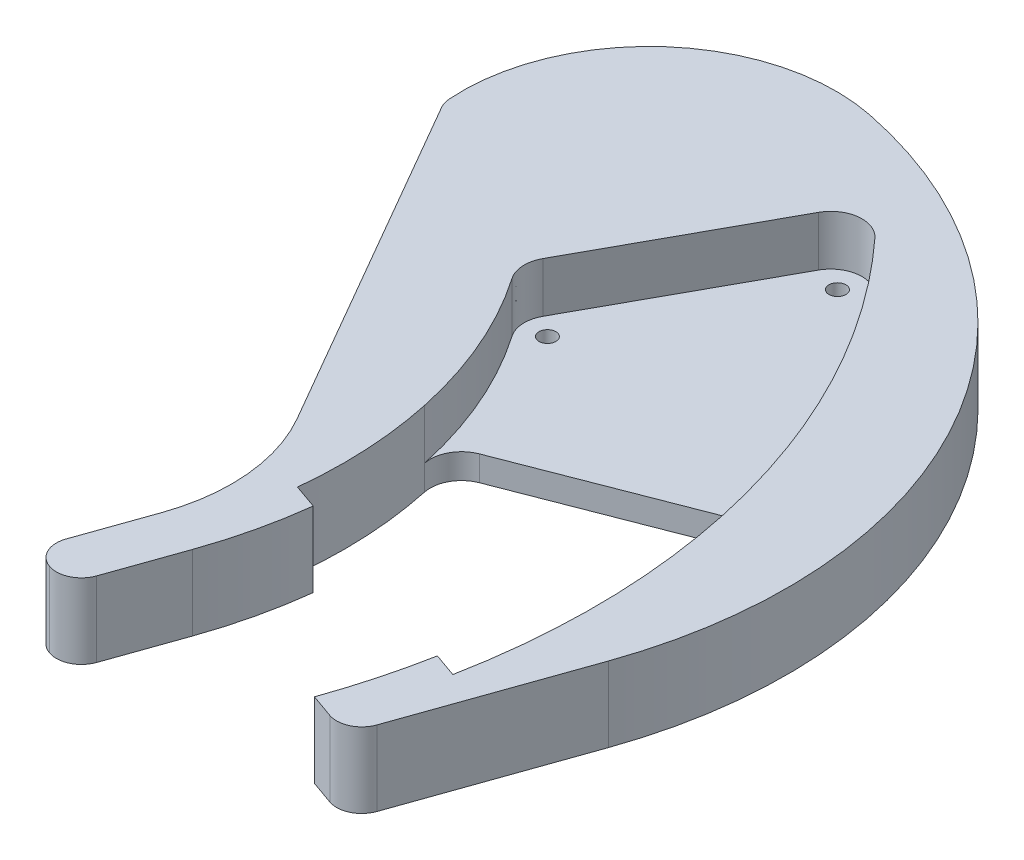
from build123d import *

# Parameters (mm, degrees)
BOSS_EXTRUDE1_DEPTH   = 19.05
CUT_EXTRUDE1_DEPTH    = 219.215212878
CUT_EXTRUDE2_DEPTH    = 12.7
BOSS_EXTRUDE2_DEPTH   = 19.05
FILLET1_R             = 6.35
F_8_CLEARANCE_HOLE1_D = 4.3053


with BuildPart() as part:
    # Sketch1 → Boss-Extrude1 (new body)
    with BuildSketch(Plane(origin=(0, 0, 0), x_dir=(1, 0, 0), z_dir=(0, 1, 0))):
        with BuildLine():
            Line((-47.453228006, 53.404284402), (-98.253228006, 141.392465427))
            ThreePointArc((-98.253228006, 141.392465427), (-82.921975522, 181.453316928), (-41.566473575, 192.839342769))
            ThreePointArc((-41.566473575, 192.839342769), (36.836225704, 136.004392842), (45.380299153, 39.546144899))
            Line((45.380299153, 39.546144899), (27.944541838, -9.861512816))
            Line((27.944541838, -9.861512816), (0, 0))
            Line((0, 0), (-43.950457827, 15.509934128))
            ThreePointArc((-43.950457827, 15.509934128), (-41.550098289, 34.840876427), (-47.453228006, 53.404284402))
        make_face()
    extrude(amount=BOSS_EXTRUDE1_DEPTH)

    # Sketch5 → Cut-Extrude1 (cut, through all)
    with BuildSketch(Plane(origin=(0, 19.05, 0), x_dir=(1, 0, 0), z_dir=(0, 1, 0))):
        with BuildLine():
            Line((-29.23664893, 81.427581144), (15.574383155, 98.792652007))
            ThreePointArc((15.574383155, 98.792652007), (22.053436092, 98.460407789), (26.120098061, 93.405630482))
            ThreePointArc((26.120098061, 93.405630482), (31.67419382, 55.261505814), (28.616328902, 16.836622098))
            Line((28.616328902, 16.836622098), (22.559524164, 18.974043348))
            ThreePointArc((22.559524164, 18.974043348), (19.726825076, 6.545871538), (15.949337201, -5.628454892))
            Line((15.949337201, -5.628454892), (-31.95525319, 11.276876204))
            ThreePointArc((-31.95525319, 11.276876204), (-28.372538305, 23.563648828), (-26.173781301, 36.171824553))
            Line((-26.173781301, 36.171824553), (-32.322028113, 38.341515332))
            ThreePointArc((-32.322028113, 38.341515332), (-31.887912186, 55.427050363), (-34.131380562, 72.370214577))
            ThreePointArc((-34.131380562, 72.370214577), (-33.353370645, 77.801041885), (-29.23664893, 81.427581144))
        make_face()
    extrude(amount=-CUT_EXTRUDE1_DEPTH, mode=Mode.SUBTRACT)

    # Sketch6 → Cut-Extrude2 (cut)
    with BuildSketch(Plane(origin=(0, 19.05, 0), x_dir=(1, 0, 0), z_dir=(0, 1, 0))):
        with BuildLine():
            Line((-34.136031583, 72.371811773), (26.116293886, 93.401758977))
            add(Edge.make_bspline(
                [(26.116293886, 93.401758977), (24.324889601, 100.23803776), (22.130168151, 106.901258397), (16.96212823, 119.893613822), (13.988046064, 126.222420918), (9.776956475, 133.921680991), (8.910007749, 135.450921337), (7.126151123, 138.487965199), (6.207974968, 139.997768114), (3.386426272, 144.480432789), (1.42392697, 147.394611788), (-4.701484626, 155.920269738), (-9.100754748, 161.316287945), (-13.809441186, 166.430246232)],
                knots=[0, 0, 0, 0, 0.25, 0.25, 0.5, 0.5, 0.5625, 0.5625, 0.625, 0.625, 0.75, 0.75, 1, 1, 1, 1], degree=3))
            add(Edge.make_bspline(
                [(-26.604572492, 164.8773905), (-26.150591479, 165.703254328), (-25.515446259, 166.400295605), (-24.879031904, 167.098729697), (-24.095373437, 167.628794259), (-23.313760397, 168.1574753), (-22.428907317, 168.488425961), (-21.547481327, 168.818094831), (-20.612298709, 168.932538075), (-19.674896196, 169.047252981), (-18.735576663, 168.938540794), (-17.797334242, 168.829953267), (-16.909699728, 168.503685222), (-16.026331795, 168.178985445), (-15.242553256, 167.655985099), (-14.452846951, 167.129029268), (-13.809441186, 166.430246232)],
                knots=[0, 0, 0, 0.125, 0.125, 0.25, 0.25, 0.375, 0.375, 0.5, 0.5, 0.625, 0.625, 0.75, 0.75, 0.875, 0.875, 1, 1, 1], degree=2))
            Line((-26.604572492, 164.8773905), (-51.39264493, 119.783935416))
            add(Edge.make_bspline(
                [(-50.971516495, 111.453693883), (-51.597295758, 112.361285599), (-51.952278538, 113.405618938), (-52.307499269, 114.450652309), (-52.364051333, 115.554155451), (-52.420577964, 116.657162304), (-52.173441916, 117.734834771), (-51.926064332, 118.813560494), (-51.39264493, 119.783935416)],
                knots=[0, 0, 0, 0.25, 0.25, 0.5, 0.5, 0.75, 0.75, 1, 1, 1], degree=2))
            add(Edge.make_bspline(
                [(-50.971516495, 111.453693883), (-48.958817602, 108.534599247), (-47.092599274, 105.523689489), (-43.653878745, 99.317766492), (-42.08164257, 96.122586505), (-39.950407344, 91.187456603), (-39.27814351, 89.518531936), (-38.021441634, 86.160956199), (-37.435479748, 84.468826365), (-36.34793939, 81.058006993), (-35.846327383, 79.339328012), (-34.927561091, 75.875386956), (-34.510190541, 74.129079907), (-34.136031583, 72.371811773)],
                knots=[0, 0, 0, 0, 0.25, 0.25, 0.5, 0.5, 0.625, 0.625, 0.75, 0.75, 0.875, 0.875, 1, 1, 1, 1], degree=3))
        make_face()
    extrude(amount=-CUT_EXTRUDE2_DEPTH, mode=Mode.SUBTRACT)

    # Sketch7 → Boss-Extrude2 (add)
    with BuildSketch(Plane(origin=(0, 0, 0), x_dir=(1, 0, 0), z_dir=(0, 1, 0))):
        Polygon((-43.950457827, 15.509934128), (-52.403123375, -8.442361068), (-40.408086707, -12.675359716), (-31.95525319, 11.276876204), align=None)
    extrude(amount=BOSS_EXTRUDE2_DEPTH)

    # Fillet1
    fillet1_edges = [part.edges().sort_by_distance(p)[0] for p in [
        (-98.253228006, 9.525, -141.392465427),
        (27.944541838, 9.525, 9.861512816),
        (-52.403123375, 9.525, 8.442361068),
        (-40.408086707, 9.525, 12.675359716),
    ]]
    fillet(fillet1_edges, radius=FILLET1_R)

    # #8 Clearance Hole1 (through all)
    with Locations(Plane(origin=(0, 0, 0), x_dir=(-1, 0, 0), z_dir=(0, -1, 0))):
        with Locations((46.39038303, 115.861048868), (19.884364695, 162.99531268)):
            Hole(F_8_CLEARANCE_HOLE1_D / 2)


solid = part.part
